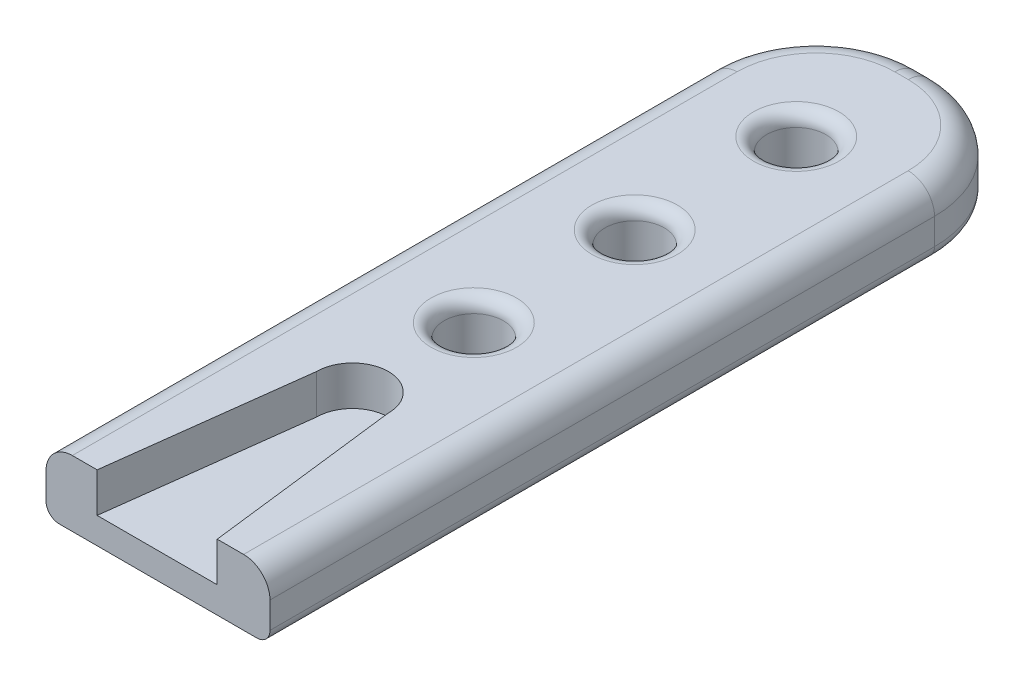
from build123d import *

# Parameters (mm, degrees)
SKETCH2_W           = 17.01772998
SKETCH2_H           = 58.499243576
SKETCH2_R           = 2.25
SKETCH2_R_2         = 2.249999999
BOSS_EXTRUDE1_DEPTH = 2
SKETCH2_7_R         = 2.25
SKETCH2_7_R_2       = 2.249999999
BOSS_EXTRUDE2_DEPTH = 5
FILLET1_R           = 8
FILLET2_R           = 2
FILLET3_R           = 1
FILLET4_R           = 1


with BuildPart() as part:
    # Sketch2 → Boss-Extrude1 (new body)
    with BuildSketch(Plane(origin=(0, 0, 0), x_dir=(1, 0, 0), z_dir=(0, 1, 0))):
        with Locations((-0.128175668, -18.695407456)):
            Rectangle(SKETCH2_W, SKETCH2_H)
        with Locations((-0.12838313, -23.94744701)):
            Circle(SKETCH2_R, mode=Mode.SUBTRACT)
        with Locations((-0.128409056, -11.721483427)):
            Circle(SKETCH2_R_2, mode=Mode.SUBTRACT)
        with Locations((-0.128292362, 0.554214332)):
            Circle(SKETCH2_R, mode=Mode.SUBTRACT)
    extrude(amount=BOSS_EXTRUDE1_DEPTH)

    # Sketch2<7> → Boss-Extrude2 (add)
    with BuildSketch(Plane(origin=(0, 0, 0), x_dir=(1, 0, 0), z_dir=(0, 1, 0))):
        with BuildLine():
            Line((-4.751975313, -47.945029244), (-2.88708064, -33.13501383))
            ThreePointArc((-2.88708064, -33.13501383), (-0.153440685, -30.408093493), (2.573479652, -33.141733448))
            Line((2.573479652, -33.141733448), (4.372168697, -47.945029244))
            Line((4.372168697, -47.945029244), (8.380689322, -47.945029244))
            Line((8.380689322, -47.945029244), (8.380689322, 10.554214332))
            Line((8.380689322, 10.554214332), (-0.128409056, 10.554214332))
            Line((-0.128409056, 10.554214332), (-8.637040658, 10.554214332))
            Line((-8.637040658, 10.554214332), (-8.637040658, -47.945029244))
            Line((-8.637040658, -47.945029244), (-4.751975313, -47.945029244))
        make_face()
        with Locations((-0.12838313, -23.94744701)):
            Circle(SKETCH2_7_R, mode=Mode.SUBTRACT)
        with Locations((-0.128409056, -11.721483427)):
            Circle(SKETCH2_7_R_2, mode=Mode.SUBTRACT)
        with Locations((-0.128292362, 0.554214332)):
            Circle(SKETCH2_7_R, mode=Mode.SUBTRACT)
    extrude(amount=BOSS_EXTRUDE2_DEPTH)

    # Fillet1
    fillet1_edges = [part.edges().sort_by_distance(p)[0] for p in [
        (-8.637040658, 2.5, -10.554214332),
        (8.380689322, 2.5, -10.554214332),
    ]]
    fillet(fillet1_edges, radius=FILLET1_R)

    # Fillet2
    fillet2_edges = [part.edges().sort_by_distance(p)[0] for p in [
        (8.380689322, 5, 22.695407456),
        (6.037543572, 5, -8.211068582),
        (-0.128175668, 5, -10.554214332),
        (-6.293894907, 5, -8.211068582),
        (-8.637040658, 5, 22.695407456),
    ]]
    fillet(fillet2_edges, radius=FILLET2_R)

    # Fillet3
    fillet3_edges = [part.edges().sort_by_distance(p)[0] for p in [
        (-2.37838313, 0, 23.94744701),
        (-2.378409055, 0, 11.721483427),
        (-2.378292362, 0, -0.554214332),
        (-2.378292362, 5, -0.554214332),
        (-2.378409055, 5, 11.721483427),
        (-2.37838313, 5, 23.94744701),
    ]]
    fillet(fillet3_edges, radius=FILLET3_R)

    # Fillet4
    fillet4_edges = [part.edges().sort_by_distance(p)[0] for p in [
        (-8.637040658, 0, 22.695407456),
        (-6.293894907, 0, -8.211068582),
        (-0.128175668, 0, -10.554214332),
        (6.037543572, 0, -8.211068582),
        (8.380689322, 0, 22.695407456),
    ]]
    fillet(fillet4_edges, radius=FILLET4_R)


solid = part.part
